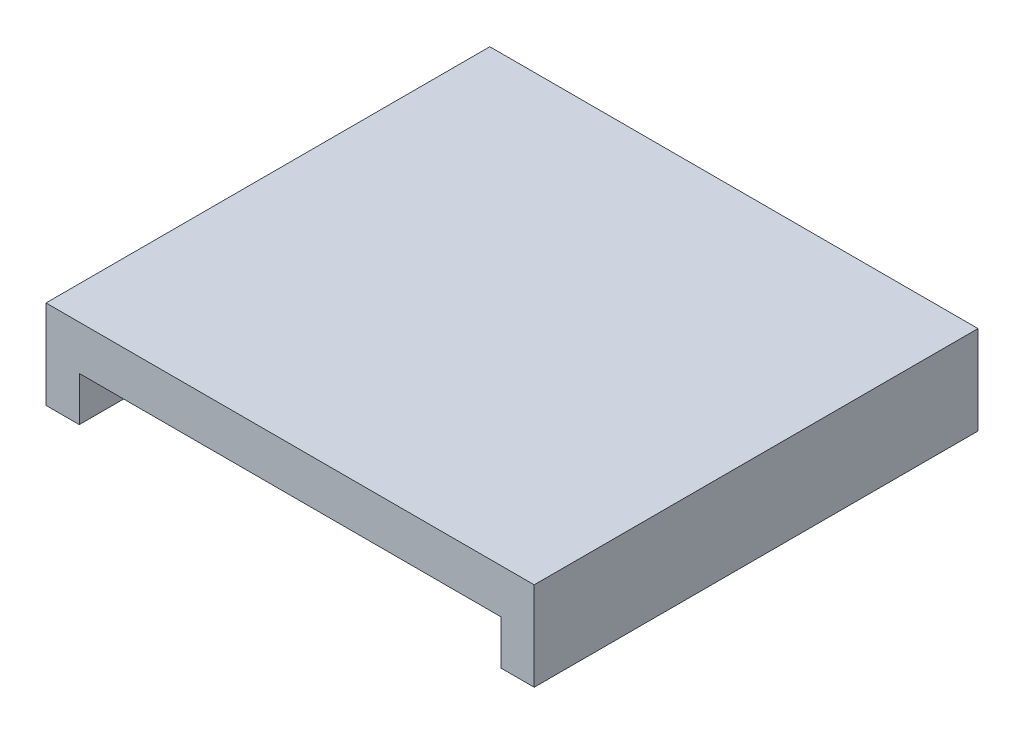
from build123d import *

# Parameters (mm, degrees)
SKETCH2_W           = 220
SKETCH2_H           = 200
BOSS_EXTRUDE1_DEPTH = 20
SKETCH3_W           = 15
SKETCH3_H           = 200
BOSS_EXTRUDE2_DEPTH = 20


with BuildPart() as part:
    # Sketch2 → Boss-Extrude1 (new body)
    with BuildSketch(Plane(origin=(0, 0, 0), x_dir=(1, 0, 0), z_dir=(0, 1, 0))):
        Rectangle(SKETCH2_W, SKETCH2_H)
    extrude(amount=BOSS_EXTRUDE1_DEPTH)

    # Sketch3 → Boss-Extrude2 (add)
    with BuildSketch(Plane.XZ):
        with Locations((-102.5, 0)):
            Rectangle(SKETCH3_W, SKETCH3_H)
        with Locations((102.5, 0)):
            Rectangle(SKETCH3_W, SKETCH3_H)
    extrude(amount=BOSS_EXTRUDE2_DEPTH)


solid = part.part
